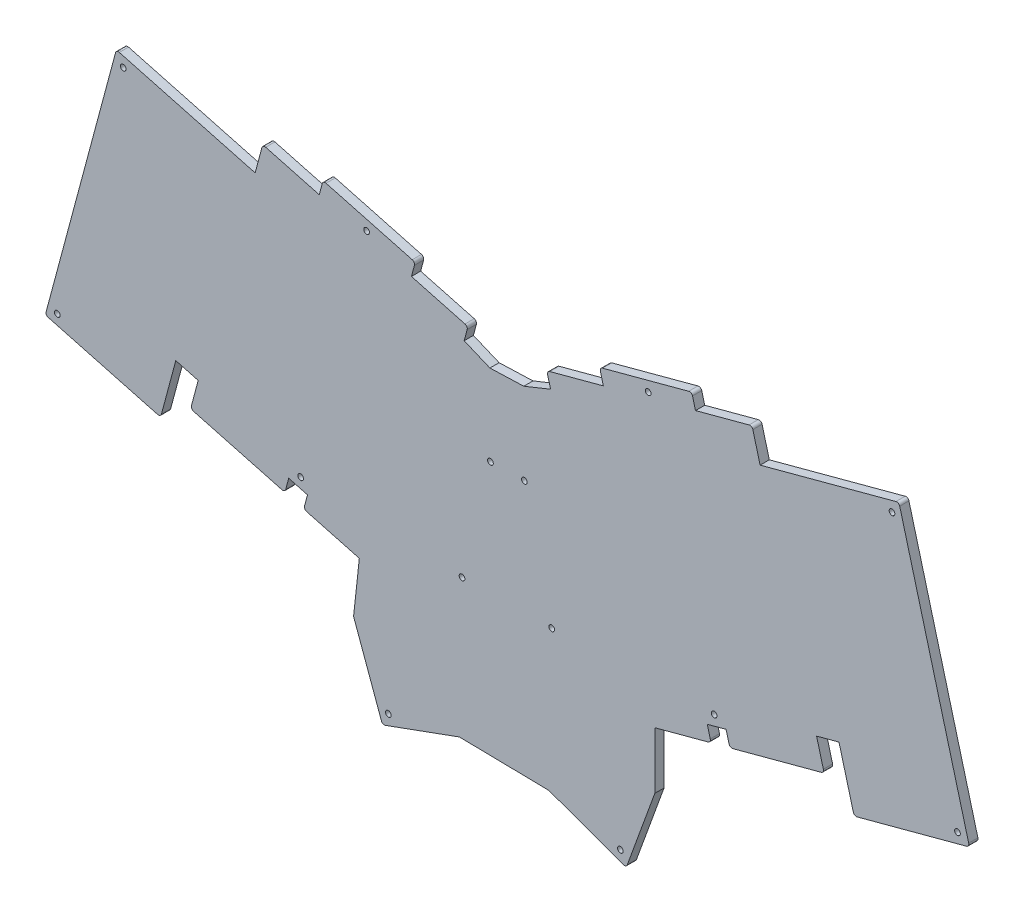
from build123d import *

# Parameters (mm, degrees)
MODEL_R             = 0.925
BOSS_EXTRUDE1_DEPTH = 3
FILLET1_R           = 1


with BuildPart() as part:
    # Model → Boss-Extrude1 (new body)
    with BuildSketch(Plane.XY):
        Polygon((142.344747242, 270.871489374), (153.37187249, 271.263447748), (162.091473536, 274.767362889), (160.85900272, 279.367807803), (179.260689602, 284.297666211), (178.028627015, 288.898354165), (208.019481767, 296.93522173), (209.252454514, 292.334187025), (227.65276755, 297.263677376), (230.276744897, 287.46915479), (275.445873116, 299.572514112), (298.39980436, 213.909597233), (260.87259576, 203.855963236), (255.943287021, 222.255598366), (248.650938057, 220.301667543), (251.115775513, 211.101166572), (220.422247557, 202.878292884), (219.189771603, 207.477473721), (213.081966369, 205.841177268), (214.314693354, 201.241059665), (196.039346948, 196.343682115), (196.007810089, 177.840578221), (186.702312667, 152.27893851), (161.565977706, 161.426447529), (132.435827139, 161.934428279), (107.399642776, 152.824765622), (97.980730454, 178.710864183), (99.858189105, 195.997881416), (81.758593313, 200.846808858), (82.991121062, 205.447466285), (76.882860045, 207.083884844), (75.650856625, 202.485184579), (44.956891994, 210.708175253), (47.421773629, 219.90863481), (40.129543563, 221.862285479), (35.199939127, 203.463086712), (-2.32684459, 213.517448416), (20.785545351, 299.774827661), (65.955825932, 287.671594898), (68.42160019, 296.872525865), (86.820985153, 291.940533454), (88.054439652, 296.542595671), (118.044472643, 288.503706576), (116.812112756, 283.905728394), (135.211333861, 278.973779905), (133.979081507, 274.376202933), align=None)
        with Locations((23.035554, 295.877718337)):
            Circle(MODEL_R, mode=Mode.SUBTRACT)
        with Locations((109.301822433, 156.902965293)):
            Circle(MODEL_R, mode=Mode.SUBTRACT)
        with Locations((184.800560745, 156.35733766)):
            Circle(MODEL_R, mode=Mode.SUBTRACT)
        with Locations((193.847437398, 289.84318413)):
            Circle(MODEL_R, mode=Mode.SUBTRACT)
        with Locations((102.225689846, 289.449650012)):
            Circle(MODEL_R, mode=Mode.SUBTRACT)
        with Locations((273.195899511, 295.675384555)):
            Circle(MODEL_R, mode=Mode.SUBTRACT)
        with Locations((1.570241786, 215.767496811)):
            Circle(MODEL_R, mode=Mode.SUBTRACT)
        with Locations((294.502731407, 216.159668876)):
            Circle(MODEL_R, mode=Mode.SUBTRACT)
        with Locations((80.760413887, 209.339268578)):
            Circle(MODEL_R, mode=Mode.SUBTRACT)
        with Locations((215.312231294, 209.732861073)):
            Circle(MODEL_R, mode=Mode.SUBTRACT)
        with Locations((133.281102646, 207.339464548)):
            Circle(MODEL_R, mode=Mode.SUBTRACT)
        with Locations((162.46850521, 207.598897954)):
            Circle(MODEL_R, mode=Mode.SUBTRACT)
        with Locations((142.522359716, 244.531276159)):
            Circle(MODEL_R, mode=Mode.SUBTRACT)
        with Locations((153.549484965, 244.723703681)):
            Circle(MODEL_R, mode=Mode.SUBTRACT)
    extrude(amount=BOSS_EXTRUDE1_DEPTH)

    # Fillet1
    fillet1_edges = [part.edges().sort_by_distance(p)[0] for p in [
        (-2.32684459, 213.517448416, 1.5),
        (20.785545351, 299.774827661, 1.5),
        (68.42160019, 296.872525865, 1.5),
        (88.054439652, 296.542595671, 1.5),
        (118.044472643, 288.503706576, 1.5),
        (135.211333861, 278.973779905, 1.5),
        (160.85900272, 279.367807803, 1.5),
        (178.028627015, 288.898354165, 1.5),
        (208.019481767, 296.93522173, 1.5),
        (227.65276755, 297.263677376, 1.5),
        (275.445873116, 299.572514112, 1.5),
        (298.39980436, 213.909597233, 1.5),
        (260.87259576, 203.855963236, 1.5),
        (251.115775513, 211.101166572, 1.5),
        (220.422247557, 202.878292884, 1.5),
        (214.314693354, 201.241059665, 1.5),
        (186.702312667, 152.27893851, 1.5),
        (107.399642776, 152.824765622, 1.5),
        (81.758593313, 200.846808858, 1.5),
        (75.650856625, 202.485184579, 1.5),
        (44.956891994, 210.708175253, 1.5),
        (35.199939127, 203.463086712, 1.5),
    ]]
    fillet(fillet1_edges, radius=FILLET1_R)


solid = part.part
